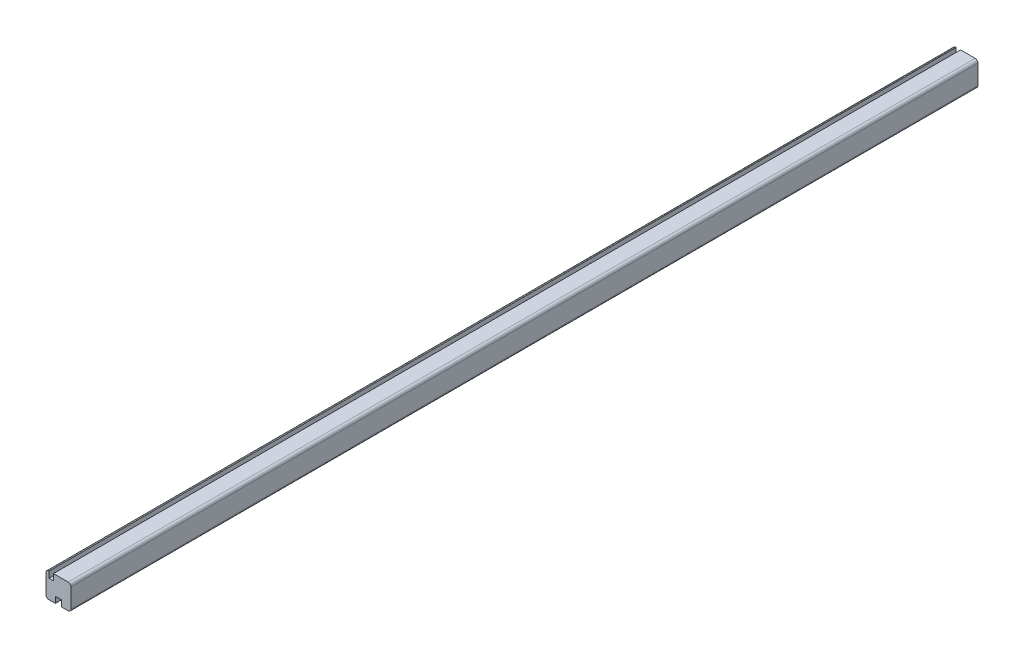
from build123d import *

# Parameters (mm, degrees)
BOSS_EXTRUDE1_DEPTH = 1455


with BuildPart() as part:
    # Sketch1 → Boss-Extrude1 (new body)
    with BuildSketch(Plane.XY):
        with BuildLine():
            Line((-15.5, -20), (-5, -20))
            Line((-5, -20), (-5, -10))
            Line((-5, -10), (5, -10))
            Line((5, -10), (5, -20))
            Line((5, -20), (15.5, -20))
            ThreePointArc((15.5, -20), (18.681980515, -18.681980515), (20, -15.5))
            Line((20, -15.5), (20, 15.5))
            ThreePointArc((20, 15.5), (18.681980515, 18.681980515), (15.5, 20))
            Line((15.5, 20), (-8, 20))
            Line((-8, 20), (-8, 10))
            Line((-8, 10), (-15, 10))
            Line((-15, 10), (-15, 20))
            Line((-15, 20), (-15.5, 20))
            ThreePointArc((-15.5, 20), (-18.681980515, 18.681980515), (-20, 15.5))
            Line((-20, 15.5), (-20, -15.5))
            ThreePointArc((-20, -15.5), (-18.681980515, -18.681980515), (-15.5, -20))
        make_face()
    extrude(amount=BOSS_EXTRUDE1_DEPTH)


solid = part.part
